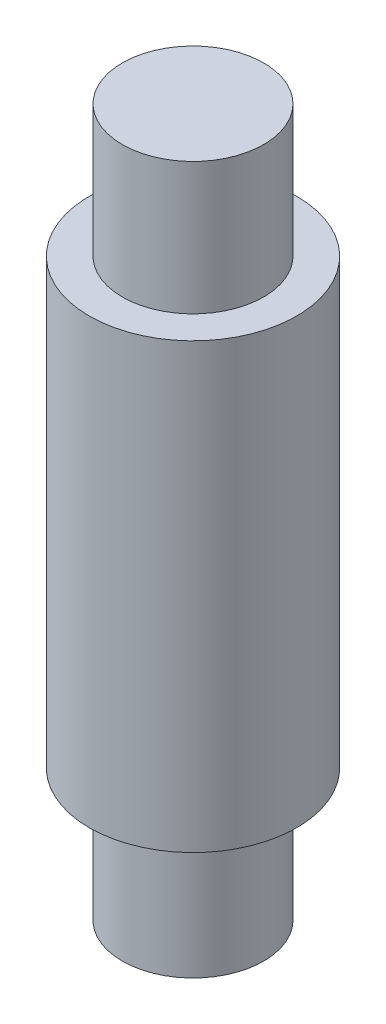
from build123d import *


with BuildPart() as part:
    # Sketch1 → Revolve1 (revolve)
    with BuildSketch(Plane.XY, mode=Mode.PRIVATE) as revolve1_sk:
        Polygon((0, 0), (15, 0), (15, 28), (22, 28), (22, 122), (15, 122), (15, 150), (0, 150), align=None)
    revolve(revolve1_sk.sketch.rotate(Axis((0, 150, 0), (0, -1, 0)), 90), axis=Axis((0, 150, 0), (0, -1, 0)))


solid = part.part
